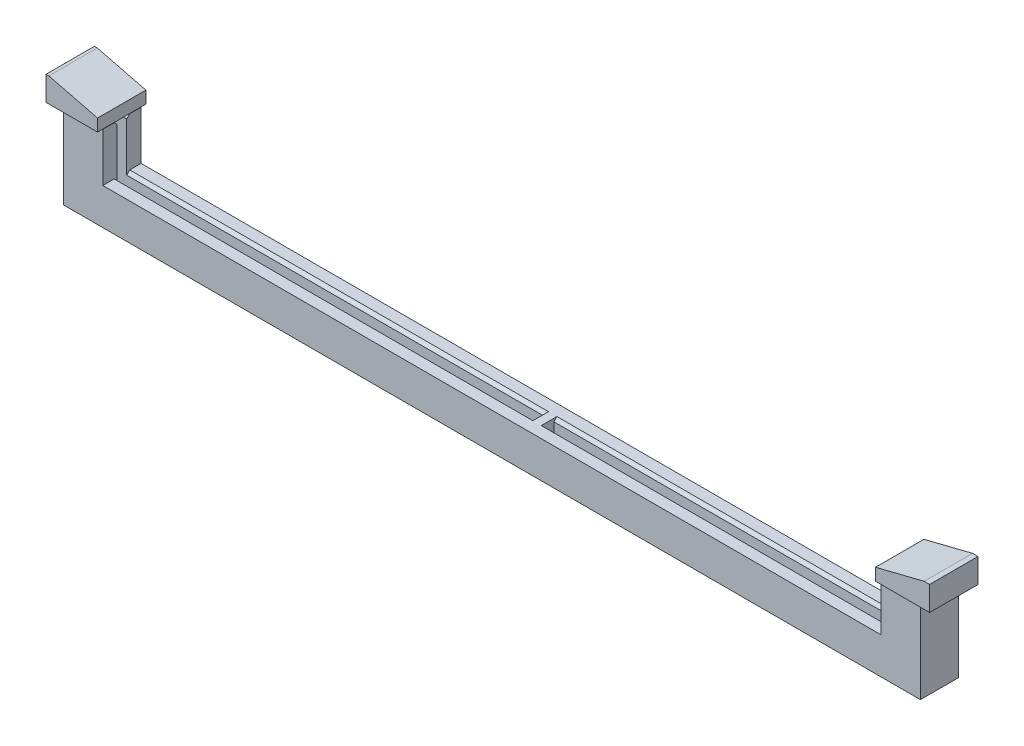
from build123d import *
from OCP.BRepFilletAPI import BRepFilletAPI_MakeChamfer

# Parameters (mm, degrees)
SKETCH1_W           = 140.96
SKETCH1_H           = 6.3
BOSS_EXTRUDE1_DEPTH = 6
SKETCH2_W           = 6.5
SKETCH2_H           = 6.3
BOSS_EXTRUDE2_DEPTH = 8
SKETCH3_W           = 71.75
SKETCH3_H           = 1.57
SKETCH3_W_2         = 60.6
CUT_EXTRUDE1_DEPTH  = 13
CHAMFER1_SIZE       = 0.5
SKETCH5_W           = 8.468797777
SKETCH5_H           = 7.958933252
SKETCH5_W_2         = 8.892237666
BOSS_EXTRUDE3_DEPTH = 4
CHAMFER2_SIZE       = 2
CHAMFER2_SIZE2      = 8


with BuildPart() as part:
    # Sketch1 → Boss-Extrude1 (new body)
    with BuildSketch(Plane(origin=(0, 0, 0), x_dir=(1, 0, 0), z_dir=(0, 1, 0))):
        Rectangle(SKETCH1_W, SKETCH1_H)
    extrude(amount=BOSS_EXTRUDE1_DEPTH)

    # Sketch2 → Boss-Extrude2 (add)
    with BuildSketch(Plane(origin=(0, 6, 0), x_dir=(1, 0, 0), z_dir=(0, 1, 0))):
        with Locations((67.23, 0)):
            Rectangle(SKETCH2_W, SKETCH2_H)
        with Locations((-67.23, 0)):
            Rectangle(SKETCH2_W, SKETCH2_H)
    extrude(amount=BOSS_EXTRUDE2_DEPTH)

    # Sketch3 → Cut-Extrude1 (cut)
    with BuildSketch(Plane(origin=(0, 14, 0), x_dir=(1, 0, 0), z_dir=(0, 1, 0))):
        with Locations((-30.995, 0)):
            Rectangle(SKETCH3_W, SKETCH3_H)
        with Locations((36.57, 0)):
            Rectangle(SKETCH3_W_2, SKETCH3_H)
    extrude(amount=-CUT_EXTRUDE1_DEPTH, mode=Mode.SUBTRACT)

    # Chamfer1
    chamfer1_edges = [part.edges().sort_by_distance(p)[0] for p in [
        (-65.425, 14, -0.785),
        (65.425, 14, 0.785),
        (-65.425, 14, 0.785),
        (-66.87, 14, 0),
        (-29.55, 6, -0.785),
        (-29.55, 6, 0.785),
        (66.87, 14, 0),
        (65.425, 14, -0.785),
        (35.125, 6, 0.785),
        (35.125, 6, -0.785),
    ]]
    chamfer(chamfer1_edges, length=CHAMFER1_SIZE)

    # Sketch5 → Boss-Extrude3 (add)
    with BuildSketch(Plane(origin=(0, 14, 0), x_dir=(1, 0, 0), z_dir=(0, 1, 0))):
        with Locations((-68.255348276, 0)):
            Rectangle(SKETCH5_W, SKETCH5_H)
        with Locations((68.374589196, 0)):
            Rectangle(SKETCH5_W_2, SKETCH5_H)
    extrude(amount=BOSS_EXTRUDE3_DEPTH)

    # Chamfer2: one chamfer whose edges measure the first distance from different faces: ONE call of the kernel's chamfer builder (chamfer() names one face for all edges)
    chamfer2_edges_1 = [part.edges().sort_by_distance(p)[0] for p in [
        (-64.020949387, 18, 0),
    ]]
    chamfer2_side_1 = [part.faces().sort_by_distance(p)[0] for p in [
        (-64.020949387, 16, 0),
    ]]
    chamfer2_edges_2 = [part.edges().sort_by_distance(p)[0] for p in [
        (63.928470363, 18, 0),
    ]]
    chamfer2_side_2 = [part.faces().sort_by_distance(p)[0] for p in [
        (63.928470363, 16, 0),
    ]]
    chamfer2 = BRepFilletAPI_MakeChamfer(part.part.solid().wrapped)
    for e in chamfer2_edges_1:
        chamfer2.Add(CHAMFER2_SIZE, CHAMFER2_SIZE2, e.wrapped, chamfer2_side_1[0].wrapped)  # the first distance lies on this face
    for e in chamfer2_edges_2:
        chamfer2.Add(CHAMFER2_SIZE, CHAMFER2_SIZE2, e.wrapped, chamfer2_side_2[0].wrapped)  # the first distance lies on this face
    add(Compound.cast(chamfer2.Shape()), mode=Mode.REPLACE)


solid = part.part
